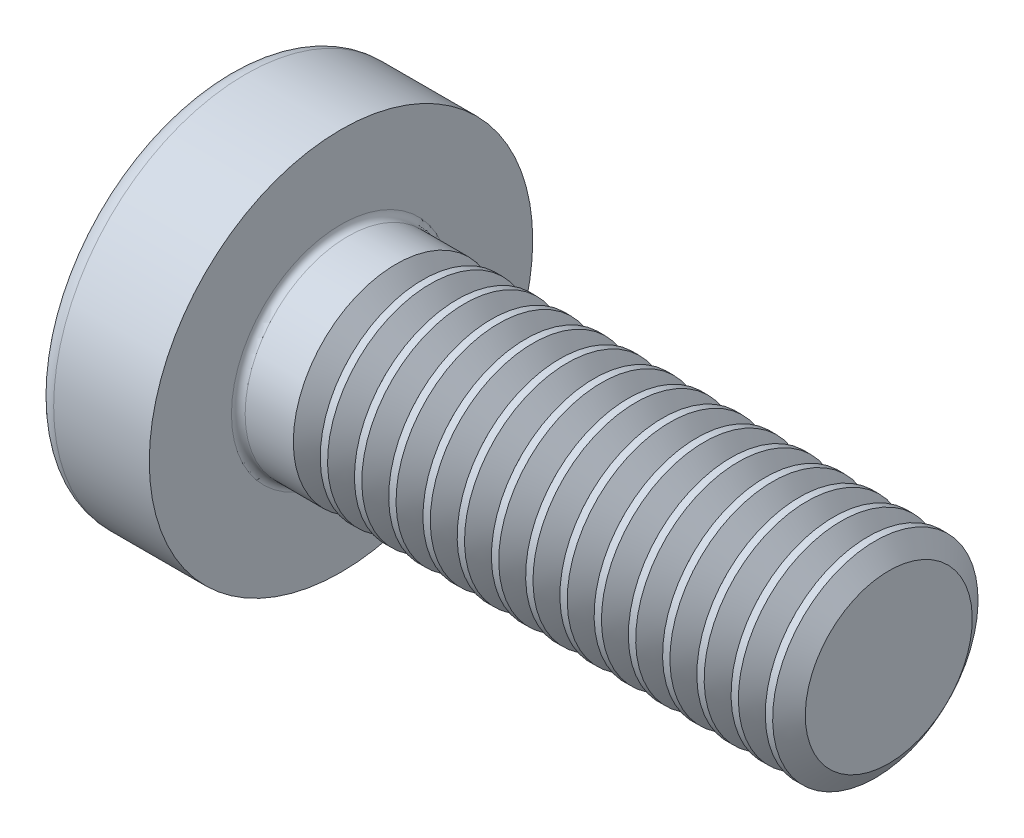
from build123d import *

# Parameters (mm, degrees)
FILLET1_R       = 0.1
RECPAT_COUNT    = 2
RECPAT_ANGLE    = 90
THDSCHPAT_COUNT = 15
THDSCHPAT_PITCH = 0.5


with BuildPart() as part:
    # BodySke → Base-Revolve (revolve)
    with BuildSketch(Plane.XY, mode=Mode.PRIVATE) as base_revolve_sk:
        with BuildLine():
            Line((2.4, 1.5), (2.4, 2.8))
            Line((2.4, 2.8), (1.003501533, 2.8))
            ThreePointArc((1.003501533, 2.8), (0.873295971, 2.76653015), (0.775371599, 2.674418605))
            ThreePointArc((0.775371599, 2.674418605), (0.197753546, 1.392274756), (0, 0))
            Line((0, 0), (10.4, 0))
            Line((10.4, 0), (10.4, 1.5))
            Line((10.4, 1.5), (2.4, 1.5))
        make_face()
    revolve(base_revolve_sk.sketch.rotate(Axis((1.003501533, 0, 0), (1, 0, 0)), 90), axis=Axis((1.003501533, 0, 0), (1, 0, 0)))

    # Fillet1
    fillet1_edges = [part.edges().sort_by_distance(p)[0] for p in [
        (2.4, 0, -1.5),
    ]]
    fillet(fillet1_edges, radius=FILLET1_R)

    # Sketch3 → Recess section 0
    with BuildSketch(Plane(origin=(0, 0, 0), x_dir=(0, 0, -1), z_dir=(1, 0, 0))):
        with BuildLine():
            Line((0.37, -1.4), (-0.37, -1.4))
            Line((-0.37, -1.4), (-0.37, 1.4))
            Line((-0.37, 1.4), (0.37, 1.4))
            Line((0.37, 1.4), (0.37, -1.4))
        make_face()
    # Sketch4 → Recess section 1
    with BuildSketch(Plane(origin=(1.75, 0, 0), x_dir=(0, 0, -1), z_dir=(1, 0, 0))):
        with BuildLine():
            Line((0.37, -0.527482332), (-0.37, -0.527482332))
            Line((-0.37, -0.527482332), (-0.37, 0.527482332))
            Line((-0.37, 0.527482332), (0.37, 0.527482332))
            Line((0.37, 0.527482332), (0.37, -0.527482332))
        make_face()
    recess = loft(mode=Mode.SUBTRACT)

    # RecPat: Recess ×2 about axis
    recpat_axis = Axis((0, 0, 0), (1, 0, 0))
    for i in range(1, RECPAT_COUNT):
        add(recess.rotate(recpat_axis, i * RECPAT_ANGLE / (RECPAT_COUNT - 1)), mode=Mode.SUBTRACT)

    # RecCorSke → RecessCore (revolve, cut)
    with BuildSketch(Plane.XY, mode=Mode.PRIVATE) as recesscore_sk:
        Polygon((0, 0), (0, 0.678371921), (1.75, 0.556), (1.930655351, 0), align=None)
    revolve(recesscore_sk.sketch.rotate(Axis((-3.175, 0, 0), (1, 0, 0)), 15.814025638), axis=Axis((-3.175, 0, 0), (1, 0, 0)), mode=Mode.SUBTRACT)

    # ThdSchSke → ThreadSchematic (revolve, cut)
    with BuildSketch(Plane.XY, mode=Mode.PRIVATE) as threadschematic_sk:
        Polygon((3.4, -1.2195), (3.203591786, -1.5), (3.203591786, -1.875), (3.596408214, -1.875), (3.596408214, -1.5), align=None)
    threadschematic = revolve(threadschematic_sk.sketch.rotate(Axis((-3.175, 0, 0), (1, 0, 0)), 270), axis=Axis((-3.175, 0, 0), (1, 0, 0)), mode=Mode.SUBTRACT)

    # ThdSchPat: ThreadSchematic ×15
    with Locations(*[(i * THDSCHPAT_PITCH, 0, 0) for i in range(1, THDSCHPAT_COUNT)]):
        add(threadschematic, mode=Mode.SUBTRACT)


solid = part.part
